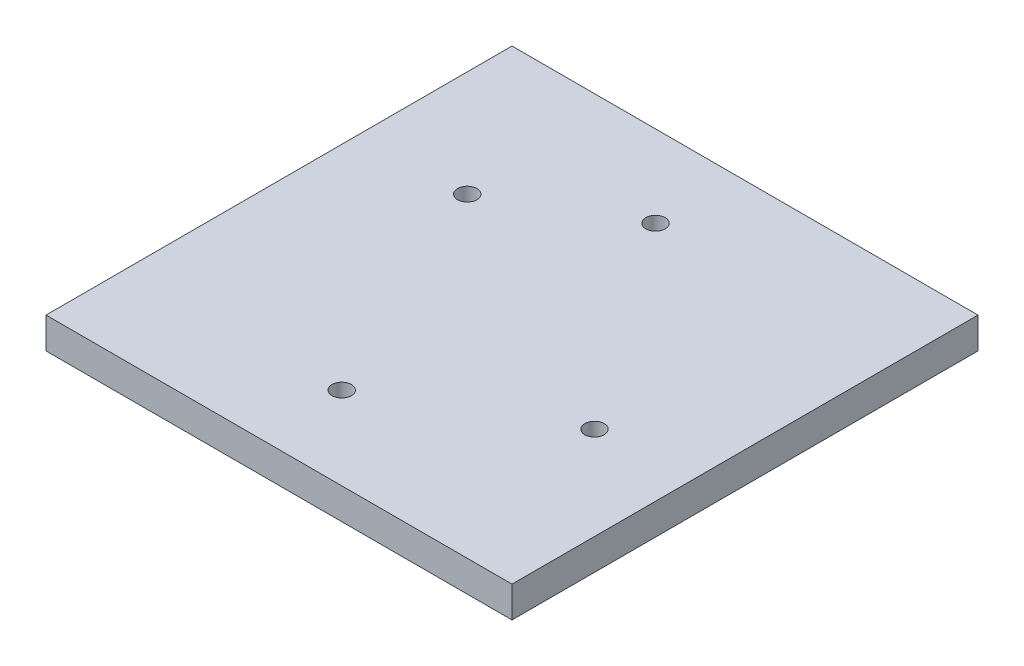
from build123d import *

# Parameters (mm, degrees)
SKETCH1_W           = 152.4
SKETCH1_H           = 152.4
BOSS_EXTRUDE1_DEPTH = 10.16
SKETCH3_R           = 38.1
BOSS_EXTRUDE3_DEPTH = 12.7
SKETCH4_R           = 4
BOSS_EXTRUDE4_DEPTH = 18
SKETCH7_R           = 3.175
CUT_EXTRUDE2_DEPTH  = 10.16


with BuildPart() as part:
    # Sketch1 → Boss-Extrude1 (new body)
    with BuildSketch(Plane(origin=(0, 0, 0), x_dir=(1, 0, 0), z_dir=(0, 1, 0))):
        Rectangle(SKETCH1_W, SKETCH1_H)
    extrude(amount=BOSS_EXTRUDE1_DEPTH)

    # Sketch3 → Boss-Extrude3 (add)
    with BuildSketch(Plane.XZ):
        with Locations(Location((0, 0, 0), (0, 0, 270))):
            Circle(SKETCH3_R)
    extrude(amount=BOSS_EXTRUDE3_DEPTH)

    # Sketch4 → Boss-Extrude4 (add)
    with BuildSketch(Plane.XZ.offset(12.7)):
        with Locations(Location((0, 0, 0), (0, 0, 270))):
            Circle(SKETCH4_R)
    extrude(amount=BOSS_EXTRUDE4_DEPTH)

    # Sketch7 → Cut-Extrude2 (cut)
    with BuildSketch(Plane(origin=(0, 10.16, 0), x_dir=(1, 0, 0), z_dir=(0, 1, 0))):
        with Locations(Location((-41.57222955, 26.925278647, 0), (0, 0, 270))):
            Circle(SKETCH7_R)
        with Locations(Location((-2.531860538, 49.465246206, 0), (0, 0, 270))):
            Circle(SKETCH7_R)
        with Locations(Location((-6.594762938, -49.089000823, 0), (0, 0, 270))):
            Circle(SKETCH7_R)
        with Locations(Location((45.809703228, -18.833268175, 0), (0, 0, 270))):
            Circle(SKETCH7_R)
    extrude(amount=-CUT_EXTRUDE2_DEPTH, mode=Mode.SUBTRACT)


solid = part.part
